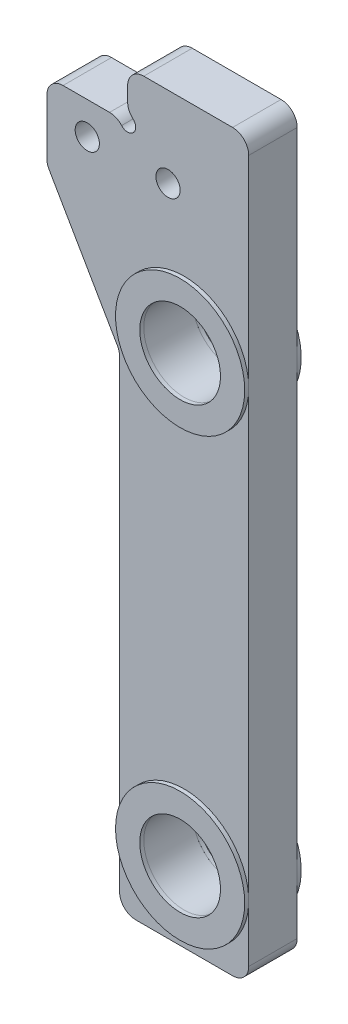
from build123d import *

# Parameters (mm, degrees)
SKETCH_1_R          = 6
SKETCH_1_R_2        = 1.5
EXTRUDE_1_DEPTH     = 6
SKETCH_2_R          = 6
SKETCH_2_R_2        = 5
EXTRUDE_2_DEPTH     = 6
EXTRUDE_2_2_DEPTH   = 6
SKETCH_3_R          = 8
SKETCH_3_R_2        = 5
EXTRUDE_3_DEPTH     = 0.5
EXTRUDE_3_2_DEPTH   = 0.5
SKETCH_4_R          = 8
SKETCH_4_R_2        = 5
EXTRUDE_4_DEPTH     = 0.5
EXTRUDE_4_2_DEPTH   = 0.5
SKETCH_5_W          = 15
SKETCH_5_H          = 6
EXTRUDE_5_DEPTH     = 6
SKETCH_6_R          = 1
CUT_EXTRUDE_1_DEPTH = 6
CUT_EXTRUDE_4_DEPTH = 6
FILLET_5_R          = 2


with BuildPart() as part:
    # 草图1 → 凸台-拉伸1 (new body)
    with BuildSketch(Plane.XY):
        Polygon((8, 20.95), (8, -64.05), (-12, -64.05), (-17, -35.693590902), (-17, 20.95), align=None)
        Circle(SKETCH_1_R, mode=Mode.SUBTRACT)
        with Locations((0, -55)):
            Circle(SKETCH_1_R, mode=Mode.SUBTRACT)
        with Locations((-2, 16.95)):
            Circle(SKETCH_1_R_2, mode=Mode.SUBTRACT)
        with Locations((-12, 16.95)):
            Circle(SKETCH_1_R_2, mode=Mode.SUBTRACT)
    extrude(amount=EXTRUDE_1_DEPTH)

    # 草图5 → 凸台-拉伸5 (add)
    with BuildSketch(Plane(origin=(0, 0, 0), x_dir=(-1, 0, 0), z_dir=(0, 0, -1))):
        with Locations((-0.5, 23.95)):
            Rectangle(SKETCH_5_W, SKETCH_5_H)
    extrude(amount=-EXTRUDE_5_DEPTH)

    # 草图6 → 切除-拉伸1 (cut)
    with BuildSketch(Plane(origin=(0, 0, 0), x_dir=(-1, 0, 0), z_dir=(0, 0, -1))):
        with Locations((7, 20.95)):
            Circle(SKETCH_6_R)
    extrude(amount=-CUT_EXTRUDE_1_DEPTH, mode=Mode.SUBTRACT)

    # 草图9 → 切除-拉伸4 (cut)
    with BuildSketch(Plane.XY.offset(6)):
        Polygon((-12, -64.05), (-8, -64.05), (-8, -4.05), (-17, 11.538457268), (-17, -35.693590902), align=None)
    extrude(amount=-CUT_EXTRUDE_4_DEPTH, mode=Mode.SUBTRACT)

    # 圆角5
    fillet_5_edges = [part.edges().sort_by_distance(p)[0] for p in [
        (8, 26.95, 3),
        (-7, 26.95, 3),
        (-7, 21.95, 3),
        (-8, 20.95, 3),
        (-8, -4.05, 3),
        (-8, -64.05, 3),
        (-17, 11.538457268, 3),
        (8, -64.05, 3),
        (-17, 20.95, 3),
    ]]
    fillet(fillet_5_edges, radius=FILLET_5_R)


with BuildPart() as body_2:
    # 草图2 → 凸台-拉伸2 (new body)
    with BuildSketch(Plane.XY.offset(6)):
        with Locations((0, -55)):
            Circle(SKETCH_2_R)
        with Locations((0, -55)):
            Circle(SKETCH_2_R_2, mode=Mode.SUBTRACT)
    extrude(amount=-EXTRUDE_2_DEPTH)


with BuildPart() as body_3:
    # 草图2 → Extrude 2 2 (new body)
    with BuildSketch(Plane.XY.offset(6)):
        Circle(SKETCH_2_R)
        Circle(SKETCH_2_R_2, mode=Mode.SUBTRACT)
    extrude(amount=-EXTRUDE_2_2_DEPTH)


with BuildPart() as body_4:
    # 草图3 → 凸台-拉伸3 (new body)
    with BuildSketch(Plane.XY.offset(6)):
        Circle(SKETCH_3_R)
        Circle(SKETCH_3_R_2, mode=Mode.SUBTRACT)
    extrude(amount=EXTRUDE_3_DEPTH)


with BuildPart() as body_5:
    # 草图3 → Extrude 3 2 (new body)
    with BuildSketch(Plane.XY.offset(6)):
        with Locations((0, -55)):
            Circle(SKETCH_3_R)
        with Locations((0, -55)):
            Circle(SKETCH_3_R_2, mode=Mode.SUBTRACT)
    extrude(amount=EXTRUDE_3_2_DEPTH)


with BuildPart() as body_6:
    # 草图4 → 凸台-拉伸4 (new body)
    with BuildSketch(Plane(origin=(0, 0, 0), x_dir=(-1, 0, 0), z_dir=(0, 0, -1))):
        with Locations((0, -55)):
            Circle(SKETCH_4_R)
        with Locations((0, -55)):
            Circle(SKETCH_4_R_2, mode=Mode.SUBTRACT)
    extrude(amount=EXTRUDE_4_DEPTH)


with BuildPart() as body_7:
    # 草图4 → Extrude 4 2 (new body)
    with BuildSketch(Plane(origin=(0, 0, 0), x_dir=(-1, 0, 0), z_dir=(0, 0, -1))):
        Circle(SKETCH_4_R)
        Circle(SKETCH_4_R_2, mode=Mode.SUBTRACT)
    extrude(amount=EXTRUDE_4_2_DEPTH)


solid = Compound([part.part, body_2.part, body_3.part, body_4.part, body_5.part, body_6.part, body_7.part])
